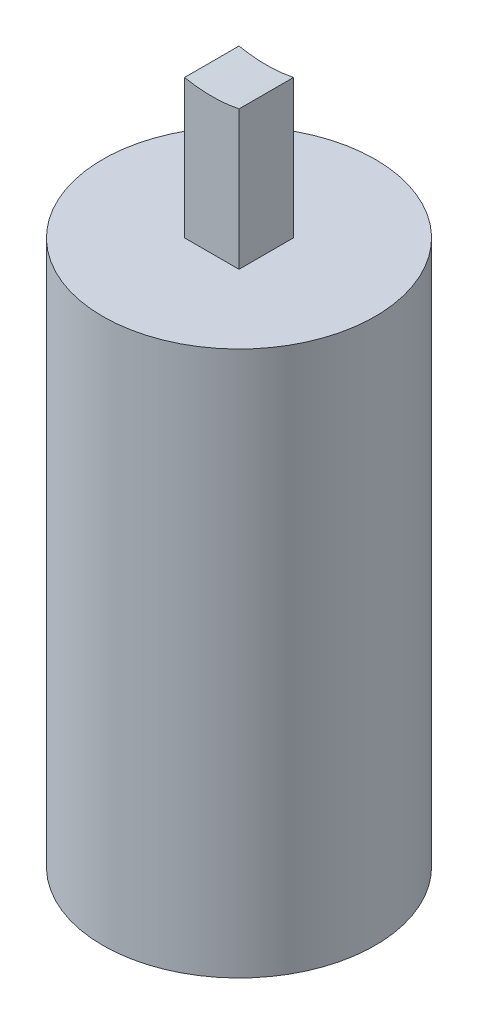
from build123d import *

# Parameters (mm, degrees)
SKETCH1_R           = 5
BOSS_EXTRUDE1_DEPTH = 20
SKETCH2_W           = 2
SKETCH2_H           = 2
BOSS_EXTRUDE2_DEPTH = 10
SKETCH3_R           = 5
CUT_EXTRUDE1_DEPTH  = 32


with BuildPart() as part:
    # Sketch1 → Boss-Extrude1 (new body)
    with BuildSketch(Plane(origin=(0, 0, 0), x_dir=(1, 0, 0), z_dir=(0, 1, 0))):
        with Locations(Location((0, 0, 0), (0, 0, 270))):
            Circle(SKETCH1_R)
    extrude(amount=BOSS_EXTRUDE1_DEPTH)

    # Sketch2 → Boss-Extrude2 (add)
    with BuildSketch(Plane(origin=(0, 20, 0), x_dir=(1, 0, 0), z_dir=(0, 1, 0))):
        Rectangle(SKETCH2_W, SKETCH2_H)
    extrude(amount=BOSS_EXTRUDE2_DEPTH)

    # Sketch3 → Cut-Extrude1 (cut, through all)
    with BuildSketch(Plane.XY.offset(1)):
        with Locations((0, 30)):
            Circle(SKETCH3_R)
    extrude(amount=-CUT_EXTRUDE1_DEPTH, mode=Mode.SUBTRACT)


solid = part.part
